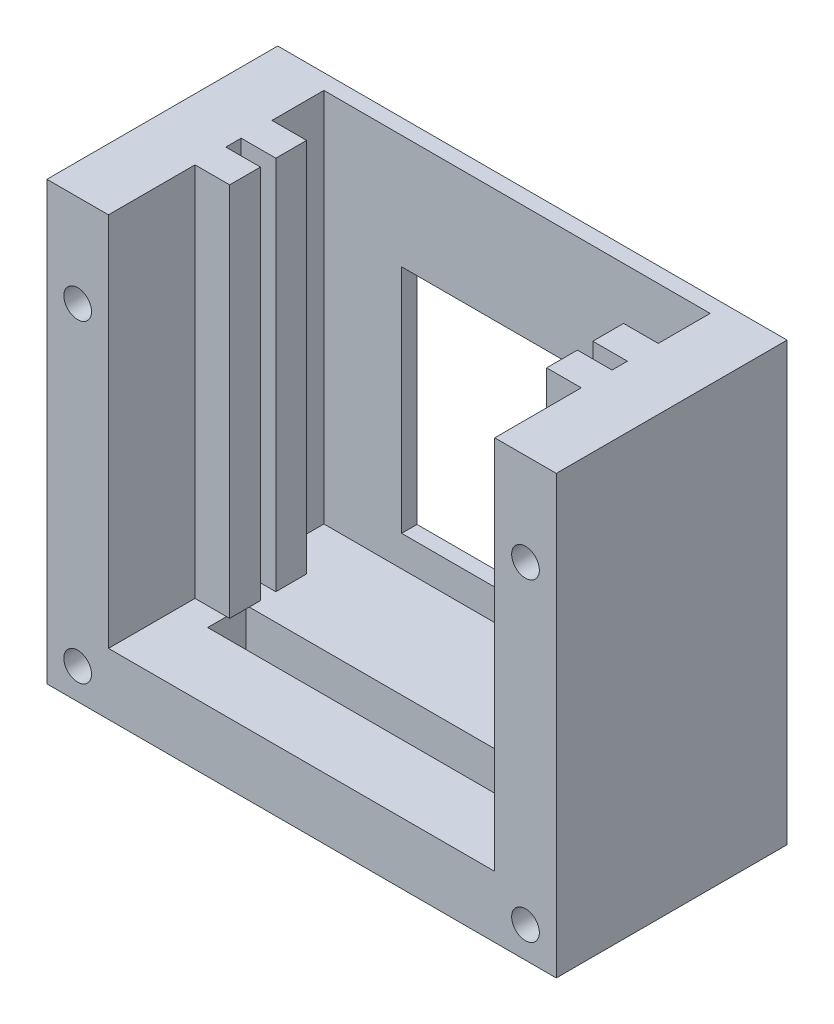
from build123d import *

# Parameters (mm, degrees)
ESQUISSE1_R             = 37
ESQUISSE1_R_2           = 1.5
ESQUISSE1_W             = 25
ESQUISSE1_H             = 3
BOSS_EXTRU_1_DEPTH      = 2
BOSS_EXTRU_2_DEPTH      = 15
ESQUISSE3_W             = 2
ESQUISSE3_H             = 28.4
BOSS_EXTRU_3_DEPTH      = 2.25
ESQUISSE5_W             = 2
ESQUISSE5_H             = 24.4
BOSS_EXTRU_4_DEPTH      = 2.25
ESQUISSE7_W             = 33.1
ESQUISSE7_H             = 28.4
BOSS_EXTRU_5_DEPTH      = 1
ESQUISSE8_W             = 15
ESQUISSE8_H             = 15
ENL_V_MAT_EXTRU_1_DEPTH = 3
ESQUISSE9_W             = 21
ESQUISSE9_H             = 2.5
ENL_V_MAT_EXTRU_2_DEPTH = 4
ESQUISSE10_R            = 0.9
ENL_V_MAT_EXTRU_3_DEPTH = 19
ENL_V_START             = -2
ESQUISSE11_R            = 37
ENL_V_MAT_EXTRU_4_DEPTH = 2


with BuildPart() as part:
    # Esquisse1 → Boss.-Extru.1 (new body)
    with BuildSketch(Plane.XY):
        Circle(ESQUISSE1_R)
        with Locations((0, 30)):
            Circle(ESQUISSE1_R_2, mode=Mode.SUBTRACT)
        with Locations((-22.874807889, 14.34375)):
            Circle(ESQUISSE1_R_2, mode=Mode.SUBTRACT)
        with Locations((-25.416453209, -15.9375)):
            Circle(ESQUISSE1_R_2, mode=Mode.SUBTRACT)
        with Locations((0, -27)):
            Circle(ESQUISSE1_R_2, mode=Mode.SUBTRACT)
        with Locations((25.416453209, -15.9375)):
            Circle(ESQUISSE1_R_2, mode=Mode.SUBTRACT)
        with Locations((22.874807889, 14.34375)):
            Circle(ESQUISSE1_R_2, mode=Mode.SUBTRACT)
        with Locations((0, -15.5)):
            Rectangle(ESQUISSE1_W, ESQUISSE1_H, mode=Mode.SUBTRACT)
    extrude(amount=BOSS_EXTRU_1_DEPTH)

    # Esquisse2 → Boss.-Extru.2 (add)
    with BuildSketch(Plane(origin=(0, 0, 0), x_dir=(-1, 0, 0), z_dir=(0, 0, -1))):
        Polygon((-16.55, 14.9), (-12.55, 14.9), (-12.55, -9.5), (12.55, -9.5), (12.55, 14.9), (16.55, 14.9), (16.55, -13.5), (-16.55, -13.5), align=None)
    extrude(amount=BOSS_EXTRU_2_DEPTH)

    # Esquisse3 → Boss.-Extru.3 (add)
    with BuildSketch(Plane(origin=(-12.55, 0, 0), x_dir=(0, 0, -1), z_dir=(1, 0, 0))):
        with Locations((9.625, 0.7)):
            Rectangle(ESQUISSE3_W, ESQUISSE3_H)
        with Locations((6.625, 0.7)):
            Rectangle(ESQUISSE3_W, ESQUISSE3_H)
    extrude(amount=BOSS_EXTRU_3_DEPTH)

    # Esquisse5 → Boss.-Extru.4 (add)
    with BuildSketch(Plane.ZY.offset(-12.55)):
        with Locations((-9.625, 2.7)):
            Rectangle(ESQUISSE5_W, ESQUISSE5_H)
        with Locations((-6.625, 2.7)):
            Rectangle(ESQUISSE5_W, ESQUISSE5_H)
    extrude(amount=BOSS_EXTRU_4_DEPTH)

    # Esquisse7 → Boss.-Extru.5 (add)
    with BuildSketch(Plane(origin=(0, 0, -15), x_dir=(-1, 0, 0), z_dir=(0, 0, -1))):
        with Locations((0, 0.7)):
            Rectangle(ESQUISSE7_W, ESQUISSE7_H)
    extrude(amount=-BOSS_EXTRU_5_DEPTH)

    # Esquisse8 → Enlèv. mat.-Extru.1 (cut)
    with BuildSketch(Plane(origin=(0, 0, -15), x_dir=(-1, 0, 0), z_dir=(0, 0, -1))):
        Rectangle(ESQUISSE8_W, ESQUISSE8_H)
    extrude(amount=-ENL_V_MAT_EXTRU_1_DEPTH, mode=Mode.SUBTRACT)

    # Esquisse9 → Enlèv. mat.-Extru.2 (cut)
    with BuildSketch(Plane.XZ.offset(13.5)):
        with Locations((0, -5.65)):
            Rectangle(ESQUISSE9_W, ESQUISSE9_H)
    extrude(amount=-ENL_V_MAT_EXTRU_2_DEPTH, mode=Mode.SUBTRACT)

    # Esquisse10 → Enlèv. mat.-Extru.3 (cut)
    with BuildSketch(Plane.XY.offset(2)):
        with Locations((-14.55, 8.9)):
            Circle(ESQUISSE10_R)
        with Locations((-14.55, -11.5)):
            Circle(ESQUISSE10_R)
        with Locations((14.55, -11.5)):
            Circle(ESQUISSE10_R)
        with Locations((14.55, 8.9)):
            Circle(ESQUISSE10_R)
    extrude(amount=-ENL_V_MAT_EXTRU_3_DEPTH, mode=Mode.SUBTRACT)

    # Esquisse11 → Enlèv. mat.-Extru.4 (cut)
    with BuildSketch(Plane.XY.offset(2).offset(ENL_V_START)):
        Circle(ESQUISSE11_R)
    extrude(amount=ENL_V_MAT_EXTRU_4_DEPTH, mode=Mode.SUBTRACT)


solid = part.part
